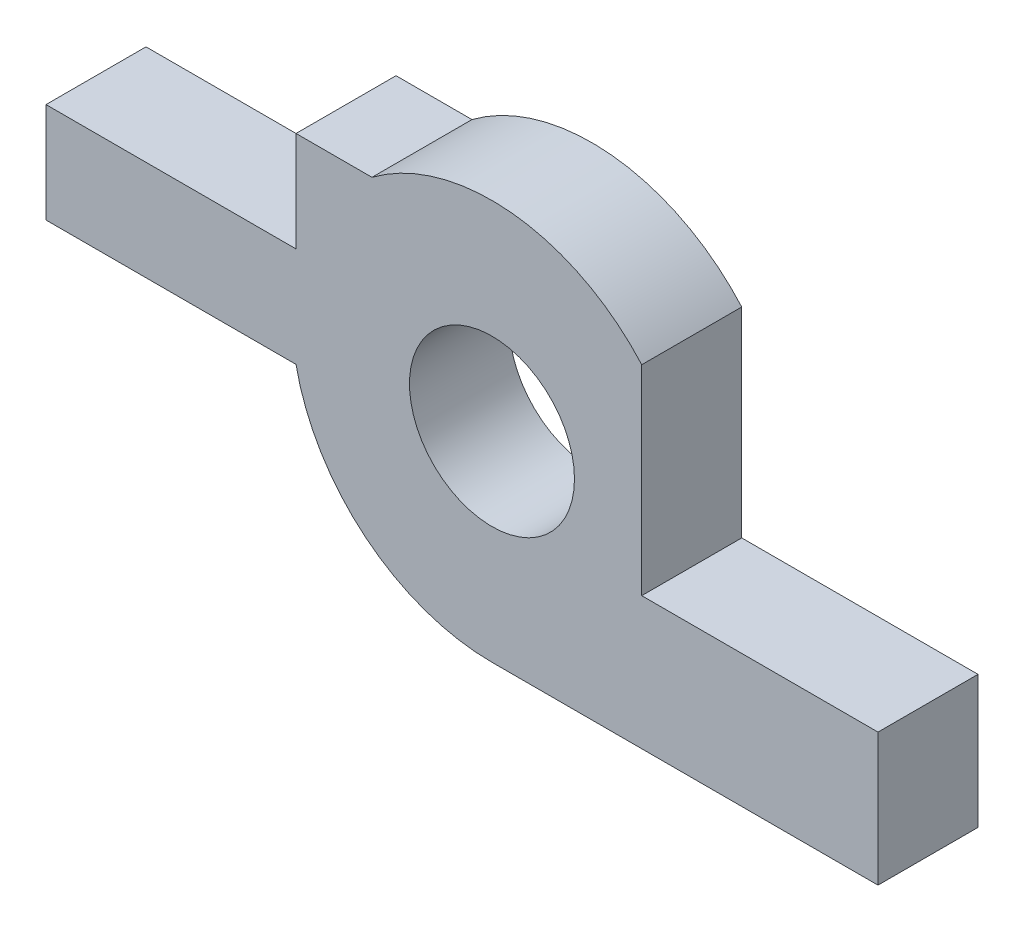
from build123d import *

# Parameters (mm, degrees)
SKETCH1_R           = 1.65
BOSS_EXTRUDE1_DEPTH = 2


with BuildPart() as part:
    # Sketch1 → Boss-Extrude1 (new body)
    with BuildSketch(Plane.XY):
        with BuildLine():
            Line((7.72, -4), (0, -4))
            ThreePointArc((0, -4), (-2.529822128, -3.098386677), (-3.919183588, -0.8))
            Line((-3.919183588, -0.8), (-8.919183588, -0.8))
            Line((-8.919183588, -0.8), (-8.919183588, 1.2))
            Line((-8.919183588, 1.2), (-3.919183588, 1.2))
            Line((-3.919183588, 1.2), (-3.919183588, 3.2))
            Line((-3.919183588, 3.2), (-2.4, 3.2))
            ThreePointArc((-2.4, 3.2), (0.404610957, 3.979483631), (2.994944065, 2.651473185))
            Line((2.994944065, 2.651473185), (2.994944065, -1.348526815))
            Line((2.994944065, -1.348526815), (7.72, -1.348526815))
            Line((7.72, -1.348526815), (7.72, -4))
        make_face()
        Circle(SKETCH1_R, mode=Mode.SUBTRACT)
    extrude(amount=BOSS_EXTRUDE1_DEPTH)


solid = part.part
